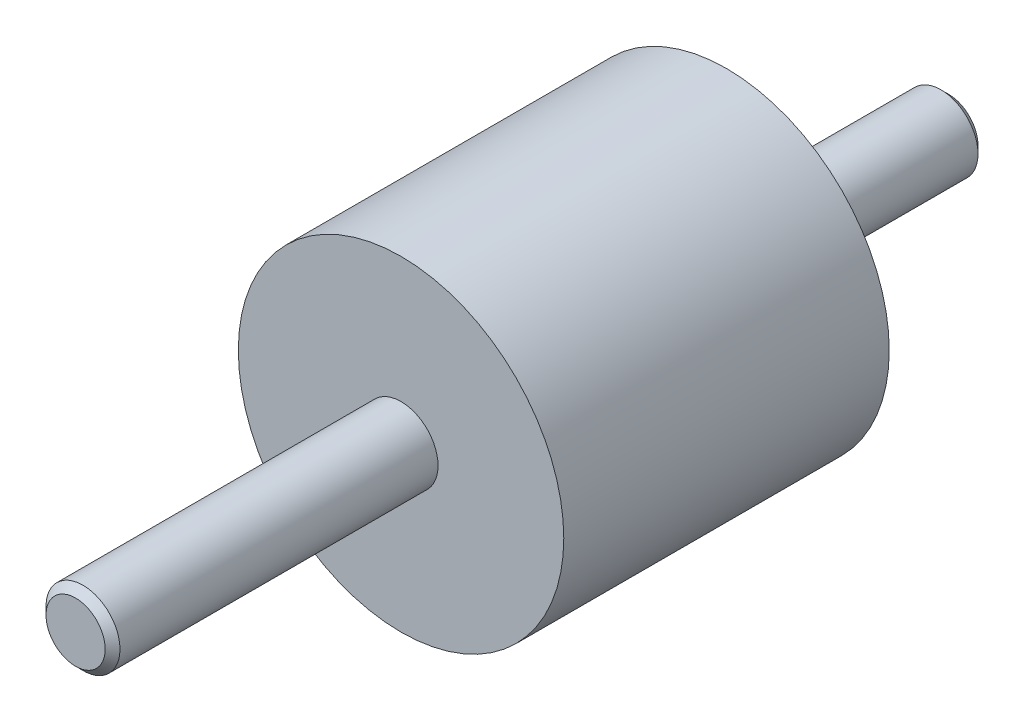
from build123d import *

# Parameters (mm, degrees)
SKETCH1_R           = 11
SKETCH1_R_2         = 2.5
BOSS_EXTRUDE1_DEPTH = 22
BOSS_EXTRUDE2_START = -15
BOSS_EXTRUDE2_DEPTH = 59
CHAMFER2_SIZE       = 0.5


with BuildPart() as part:
    # Sketch1 → Boss-Extrude1 (new body)
    # profile 1 of 5: a face of its own
    with BuildSketch(Plane.XY):
        Circle(SKETCH1_R)
        Circle(SKETCH1_R_2, mode=Mode.SUBTRACT)
    # profile 2 of 5: a face of its own
    with BuildSketch(Plane.XY):
        with BuildLine():
            ThreePointArc((1.5, 2), (0, 2.5), (-1.5, 2))
            Line((-1.5, 2), (1.5, 2))
        make_face()
    # profile 3 of 5: a face of its own
    with BuildSketch(Plane.XY):
        with BuildLine():
            Line((1.5, 2), (-1.5, 2))
            ThreePointArc((-1.5, 2), (-1.118033989, -2.236067977), (2.5, 0))
            ThreePointArc((2.5, 0), (2.236067977, 1.118033989), (1.5, 2))
        make_face()
    # profile 4 of 5: a face of its own
    with BuildSketch(Plane.XY):
        with BuildLine():
            ThreePointArc((1.5, 2), (0, 2.5), (-1.5, 2))
            Line((-1.5, 2), (1.5, 2))
        make_face()
    # profile 5 of 5: a face of its own
    with BuildSketch(Plane.XY):
        with BuildLine():
            Line((1.5, 2), (-1.5, 2))
            ThreePointArc((-1.5, 2), (-1.118033989, -2.236067977), (2.5, 0))
            ThreePointArc((2.5, 0), (2.236067977, 1.118033989), (1.5, 2))
        make_face()
    extrude(amount=BOSS_EXTRUDE1_DEPTH)

    # Sketch1<3> → Boss-Extrude2 (add)
    with BuildSketch(Plane.XY.offset(BOSS_EXTRUDE2_START)):
        with BuildLine():
            ThreePointArc((1.5, 2), (0, 2.5), (-1.5, 2))
            Line((-1.5, 2), (1.5, 2))
        make_face()
        with BuildLine():
            Line((1.5, 2), (-1.5, 2))
            ThreePointArc((-1.5, 2), (-1.118033989, -2.236067977), (2.5, 0))
            ThreePointArc((2.5, 0), (2.236067977, 1.118033989), (1.5, 2))
        make_face()
    extrude(amount=BOSS_EXTRUDE2_DEPTH)

    # Chamfer2
    chamfer2_edges = [part.edges().sort_by_distance(p)[0] for p in [
        (-2.5, 0, -15),
        (-2.5, 0, 44),
    ]]
    chamfer(chamfer2_edges, length=CHAMFER2_SIZE)


solid = part.part
